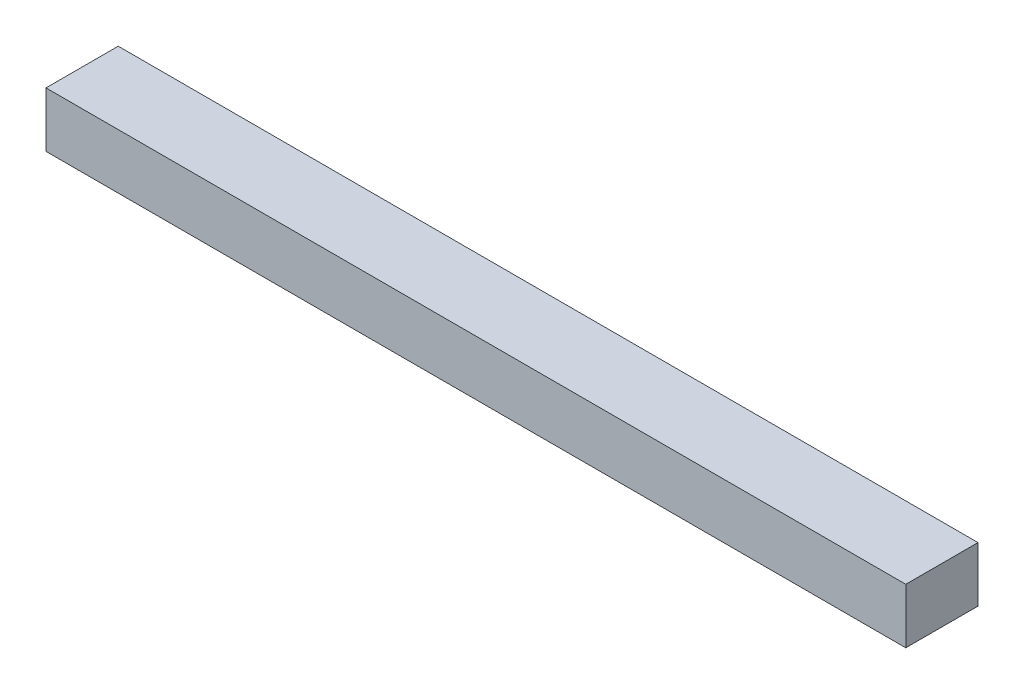
from build123d import *

# Parameters (mm, degrees)
SKETCH_1_W        = 2500
SKETCH_1_H        = 160
EXTRUDE_220_DEPTH = 210


with BuildPart() as part:
    # 草图1 → Extrude 220 (new body)
    with BuildSketch(Plane.XY):
        with Locations((1164.948484848, 59.718484848)):
            Rectangle(SKETCH_1_W, SKETCH_1_H)
    extrude(amount=EXTRUDE_220_DEPTH)


solid = part.part
